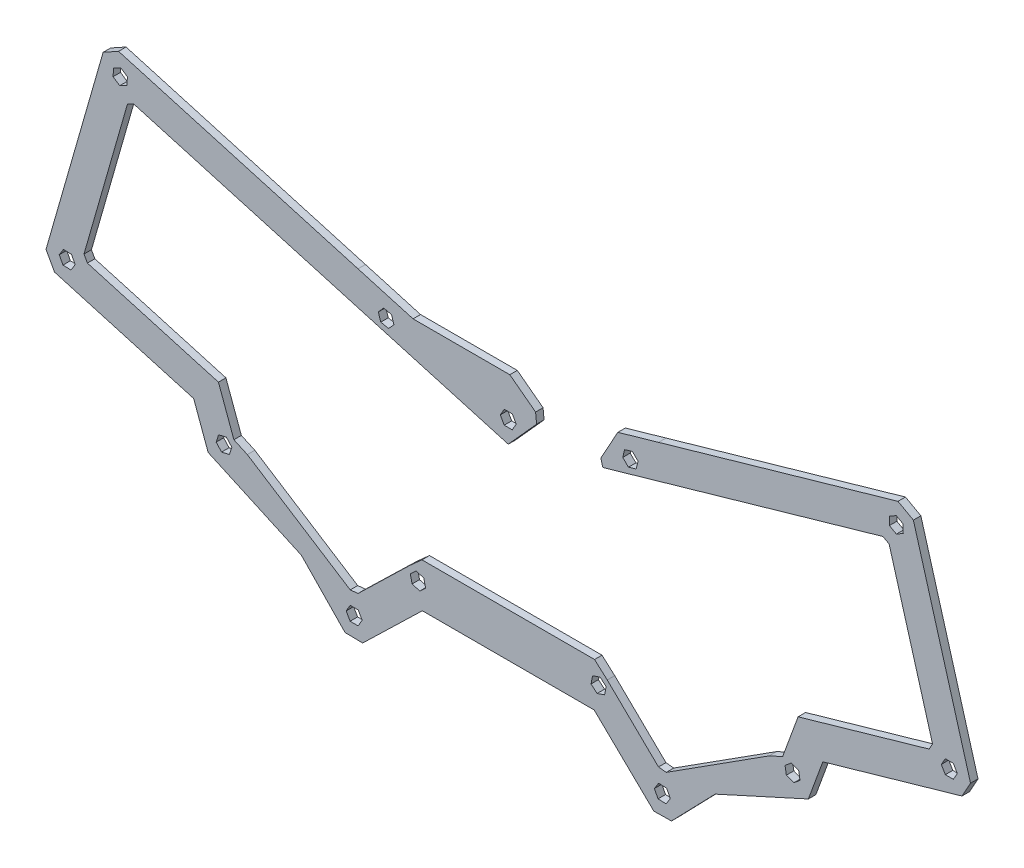
from build123d import *

# Parameters (mm, degrees)
BOSS_EXTRU_1_DEPTH = 3


with BuildPart() as part:
    # Esquisse1 → Boss.-Extru.1 (new body)
    with BuildSketch(Plane.XY):
        Polygon((-102.267806075, -134.437972545), (-84.723821109, -116.319052626), (-47.296900898, -99.298065073), (-41.491708262, -83.459404935), (14.381168218, -67.438115415), (17.809289919, -61.253620157), (-5.137146777, 18.770114611), (-11.32171868, 22.19850363), (-107.454535032, -5.36135166), (-114.180015808, -7.289852239), (-123.793577085, -10.046496577), (-130.649820486, -22.415487094), (-129.8232917, -25.297935522), (-127.904950096, -24.747859919), (-17.351203316, 6.946262636), (-14.877374555, 5.574907028), (2.556514314, -55.224288823), (1.185265633, -57.698086926), (-51.424530344, -72.783703169), (-57.630729871, -89.716454796), (-63.024672228, -92.169507978), (-104.349665635, -118.563827288), (-107.470944884, -118.248029963), (-128.050089261, -98.290842938), (-133.151477342, -93.715936913), (-202.439042401, -93.715936913), (-207.540430482, -98.290842938), (-228.119574859, -118.248029963), (-231.240854108, -118.563827288), (-272.565847516, -92.169507978), (-277.959789872, -89.716454796), (-284.165989399, -72.783703169), (-336.775785376, -57.698086926), (-338.147034057, -55.224288823), (-320.713145188, 5.574907028), (-318.239316427, 6.946262636), (-167.795259872, -36.183821192), (-156.425730461, -23.544541546), (-156.815310501, -19.508703235), (-167.175777529, -11.701531345), (-206.025150502, -11.701531345), (-221.410503936, -7.289852239), (-228.135984711, -5.36135166), (-324.268801063, 22.19850363), (-330.453372966, 18.770114611), (-353.399809662, -61.253620157), (-349.971687961, -67.438115415), (-294.098811481, -83.459404935), (-288.293618845, -99.298065073), (-250.866698634, -116.319052626), (-233.322713669, -134.437972545), (-226.255271496, -134.549159576), (-202.296830677, -111.350948678), (-133.293689066, -111.350948678), (-109.335248247, -134.549159576), align=None)
        Polygon((-214.696831686, -14.527657653), (-217.840116073, -13.876277124), (-219.975870353, -16.272750989), (-218.968340246, -19.320605385), (-215.825055858, -19.971985915), (-213.689301579, -17.575512049), align=None, mode=Mode.SUBTRACT)
        Polygon((-166.175746894, -24.833958909), (-169.385770719, -24.817214521), (-171.005283697, -27.588804506), (-169.414772849, -30.37713888), (-166.204749024, -30.393883267), (-164.585236046, -27.622293282), align=None, mode=Mode.SUBTRACT)
        Polygon((-115.672169645, -16.039488624), (-117.981174931, -13.809459943), (-121.066939064, -14.694102838), (-121.84369791, -17.808774414), (-119.534692623, -20.038803095), (-116.448928491, -19.154160201), align=None, mode=Mode.SUBTRACT)
        Polygon((-9.240055353, 15.320178943), (-12.039253575, 16.891491339), (-14.799649138, 15.252970767), (-14.76084648, 12.043137798), (-11.961648258, 10.471825402), (-9.201252694, 12.110345974), align=None, mode=Mode.SUBTRACT)
        Polygon((12.502351781, -60.574933915), (10.897318032, -57.794933915), (7.687250536, -57.794933915), (6.082216787, -60.574933915), (7.687250536, -63.354933915), (10.897318032, -63.354933915), align=None, mode=Mode.SUBTRACT)
        Polygon((-50.649763202, -94.526851626), (-51.178552765, -91.36063702), (-54.18496983, -90.235474912), (-56.662597331, -92.27652741), (-56.133807767, -95.442742016), (-53.127390703, -96.567904124), align=None, mode=Mode.SUBTRACT)
        Polygon((-104.440215275, -129.559925429), (-102.716844109, -126.851692582), (-104.200556971, -124.005092948), (-107.407640999, -123.866726161), (-109.131012166, -126.574959009), (-107.647299303, -129.421558643), align=None, mode=Mode.SUBTRACT)
        Polygon((-132.134816884, -105.032961295), (-129.102521286, -103.979530359), (-128.498671438, -100.826769871), (-130.927117189, -98.727440319), (-133.959412787, -99.780871255), (-134.563262635, -102.933631743), align=None, mode=Mode.SUBTRACT)
        Polygon((-200.986265397, -102.807259839), (-201.720052379, -99.68218544), (-204.793339689, -98.755126408), (-207.132840016, -100.953141775), (-206.399053033, -104.078216174), (-203.325765724, -105.005275206), align=None, mode=Mode.SUBTRACT)
        Polygon((-228.072581173, -129.499661036), (-226.456549288, -126.726039887), (-228.050559721, -123.939704646), (-231.260602039, -123.926990555), (-232.876633924, -126.700611704), (-231.282623491, -129.486946945), align=None, mode=Mode.SUBTRACT)
        Polygon((-279.761510176, -95.764600045), (-278.801584282, -92.701419409), (-280.974413583, -90.338508881), (-284.107168778, -91.03877899), (-285.067094671, -94.101959627), (-282.89426537, -96.464870154), align=None, mode=Mode.SUBTRACT)
        Polygon((-343.381773974, -63.412440235), (-341.674936445, -60.693756917), (-343.175966498, -57.856250598), (-346.38383408, -57.737427596), (-348.09067161, -60.456110913), (-346.589641557, -63.293617233), align=None, mode=Mode.SUBTRACT)
        Polygon((-323.377643582, 16.884689567), (-326.25776259, 15.467139628), (-326.470187835, 12.264108431), (-323.802494072, 10.478627174), (-320.922375064, 11.896177113), (-320.709949819, 15.09920831), align=None, mode=Mode.SUBTRACT)
    extrude(amount=BOSS_EXTRU_1_DEPTH)


solid = part.part
